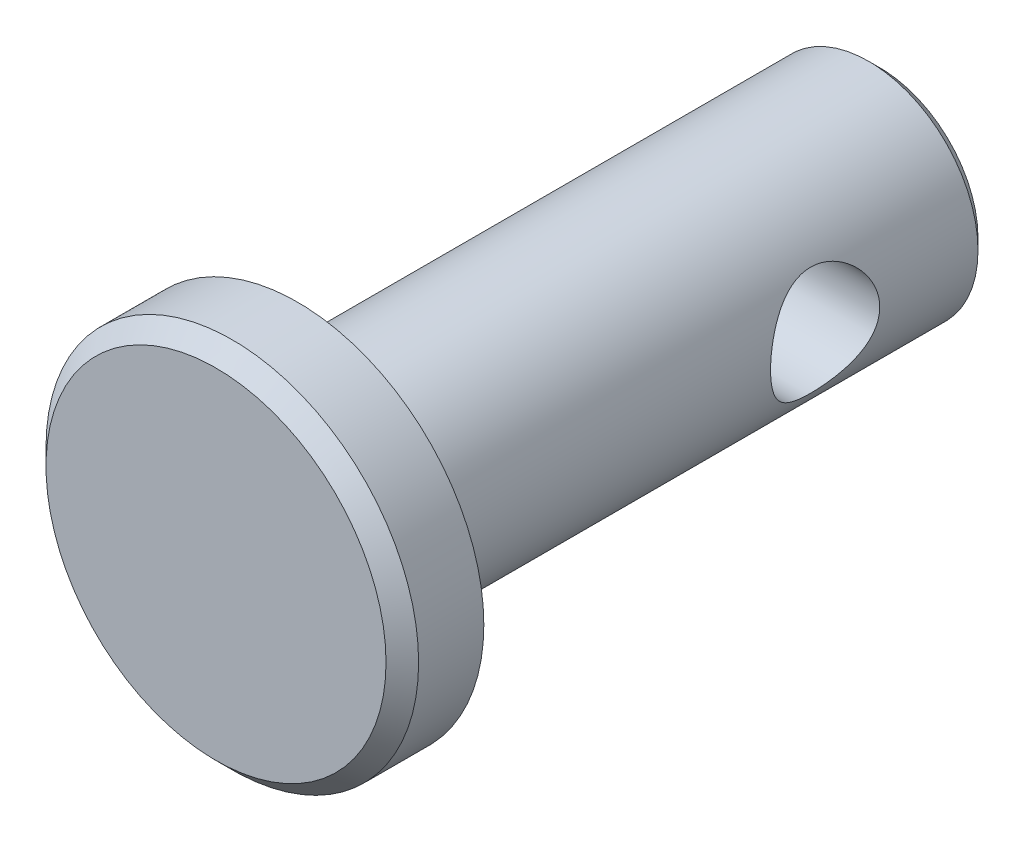
from build123d import *

# Parameters (mm, degrees)
SKETCH1_R           = 2.38125
EXTRUDE1_DEPTH      = 6.35
SKETCH2_R           = 4.064
EXTRUDE2_DEPTH      = 1.778
CHAMFER1_SIZE       = 0.3556
EXTRUDE3_DEPTH      = 10.954726315
EXTRUDE3_DEPTH_BACK = 10.954726315
SKETCH3_R           = 1.190625
CHAMFER2_SIZE       = 0.238125


with BuildPart() as part:
    # Sketch1 → Extrude1 (new, symmetric)
    with BuildSketch(Plane.XY):
        Circle(SKETCH1_R)
    extrude(amount=EXTRUDE1_DEPTH, both=True)

    # Sketch2 → Extrude2 (add)
    with BuildSketch(Plane.XY.offset(6.35)):
        Circle(SKETCH2_R)
    extrude(amount=EXTRUDE2_DEPTH)

    # Chamfer1
    chamfer1_edges = [part.edges().sort_by_distance(p)[0] for p in [
        (-4.064, 0, 8.128),
    ]]
    chamfer(chamfer1_edges, length=CHAMFER1_SIZE)

    # Sketch3 → Extrude3 (cut, two sides: drawn at the far end of the back side and taken through both)
    with BuildSketch(Plane(origin=(0, 0, 0), x_dir=(0, 0, -1), z_dir=(1, 0, 0)).offset(-EXTRUDE3_DEPTH_BACK)):
        with Locations(Location((2.778125, 0, 0), (0, 0, 179.999999999))):
            Circle(SKETCH3_R)
    extrude(amount=EXTRUDE3_DEPTH + EXTRUDE3_DEPTH_BACK, mode=Mode.SUBTRACT)

    # Chamfer2
    chamfer2_edges = [part.edges().sort_by_distance(p)[0] for p in [
        (-2.38125, 0, -6.35),
    ]]
    chamfer(chamfer2_edges, length=CHAMFER2_SIZE)


solid = part.part
